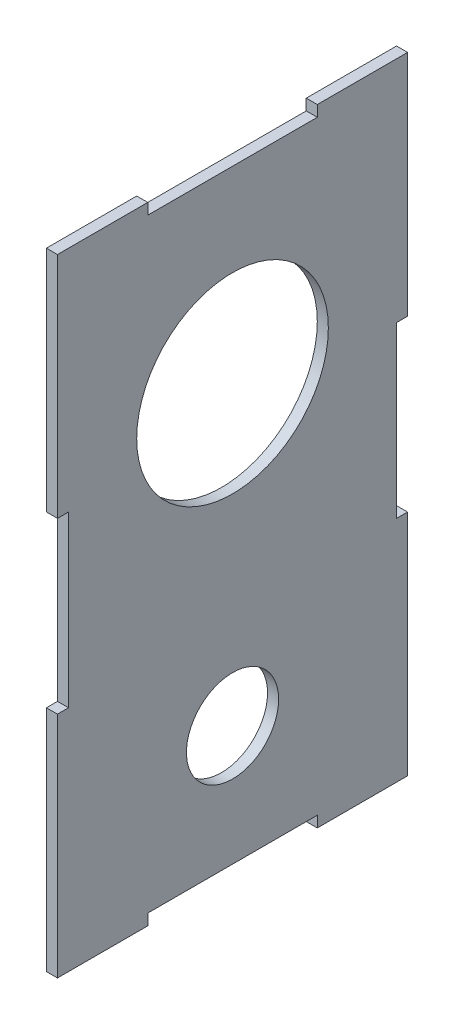
from build123d import *

# Parameters (mm, degrees)
CROQUIS1_R              = 26
CROQUIS1_R_2            = 12.5
SALIENTE_EXTRUIR1_DEPTH = 3


with BuildPart() as part:
    # Croquis1 → Saliente-Extruir1 (new body)
    with BuildSketch(Plane(origin=(0, 0, 0), x_dir=(0, 0, -1), z_dir=(1, 0, 0))):
        Polygon((-23, 82), (23, 82), (23, 85), (47.5, 85), (47.5, 23), (44.5, 23), (44.5, -23), (47.5, -23), (47.5, -85), (23, -85), (23, -82), (-23, -82), (-23, -85), (-47.5, -85), (-47.5, -23), (-44.5, -23), (-44.5, 23), (-47.5, 23), (-47.5, 85), (-23, 85), align=None)
        with Locations((0, 31)):
            Circle(CROQUIS1_R, mode=Mode.SUBTRACT)
        with Locations((0, -49.5)):
            Circle(CROQUIS1_R_2, mode=Mode.SUBTRACT)
    extrude(amount=SALIENTE_EXTRUIR1_DEPTH)


solid = part.part
